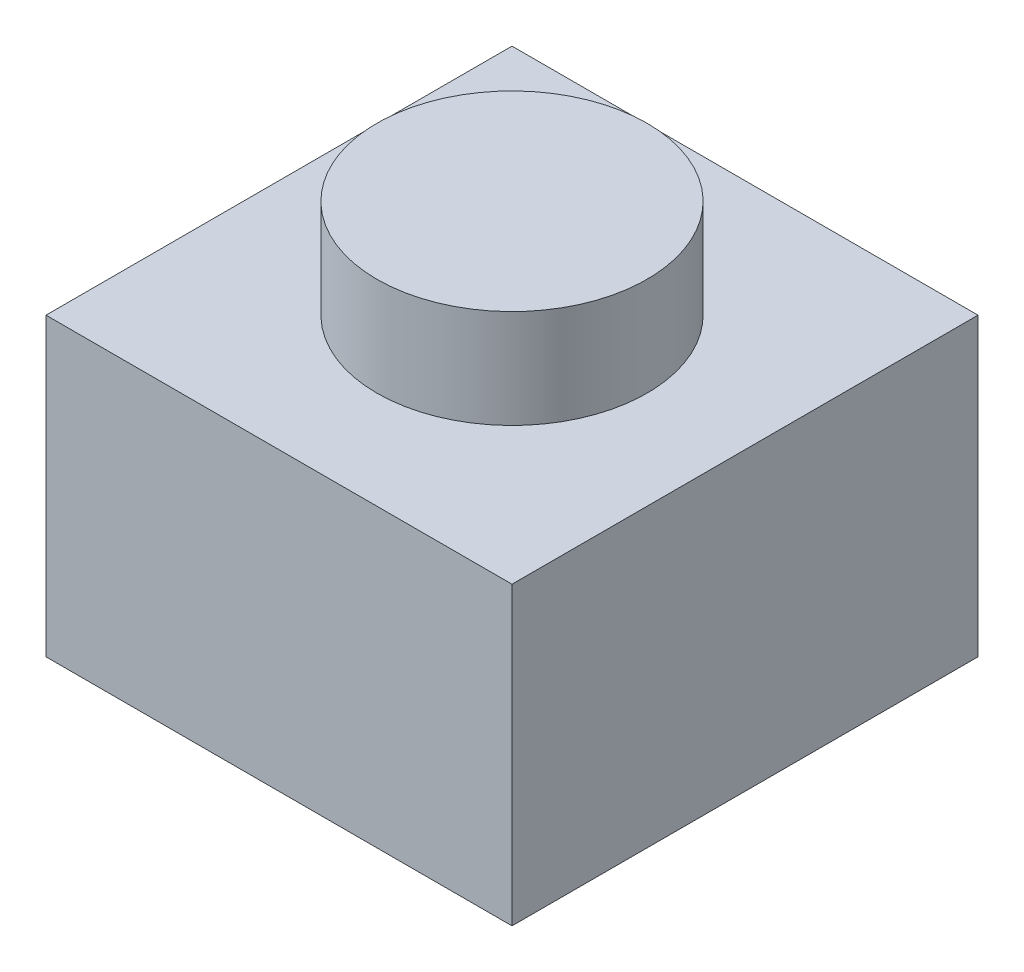
from build123d import *

# Parameters (mm, degrees)
SKETCH1_W           = 6
SKETCH1_H           = 6
BOSS_EXTRUDE1_DEPTH = 3.81
SKETCH2_R           = 1.7399
BOSS_EXTRUDE2_DEPTH = 1.27


with BuildPart() as part:
    # Sketch1 → Boss-Extrude1 (new body)
    with BuildSketch(Plane(origin=(0, 0, 0), x_dir=(1, 0, 0), z_dir=(0, 1, 0))):
        Rectangle(SKETCH1_W, SKETCH1_H)
    extrude(amount=BOSS_EXTRUDE1_DEPTH)

    # Sketch2 → Boss-Extrude2 (add)
    with BuildSketch(Plane(origin=(0, 3.81, 0), x_dir=(1, 0, 0), z_dir=(0, 1, 0))):
        with Locations(Location((0, 0, 0), (0, 0, 270))):
            Circle(SKETCH2_R)
    extrude(amount=BOSS_EXTRUDE2_DEPTH)


solid = part.part
